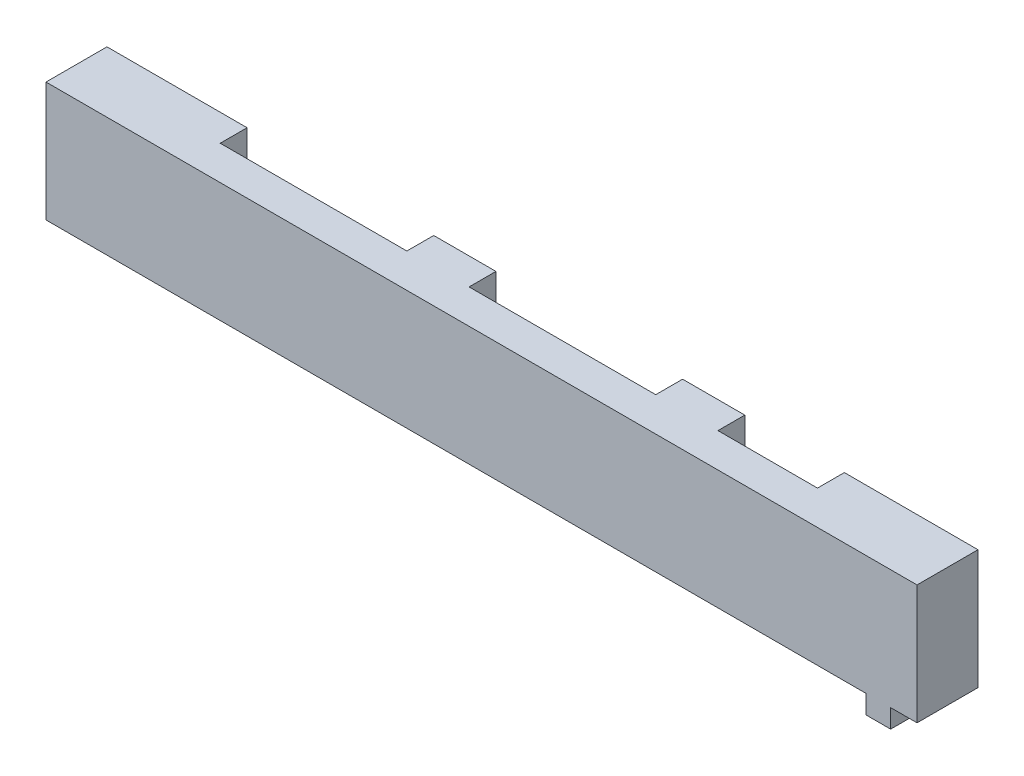
from build123d import *

# Parameters (mm, degrees)
SKETCH_1_W          = 4.9
SKETCH_1_H          = 9.6
EXTRUDE_1_DEPTH     = 70
SKETCH_2_W          = 8
SKETCH_2_H          = 2.159316865
SKETCH_2_W_2        = 15
CUT_EXTRUDE_1_DEPTH = 71.717892378
SKETCH_3_W          = 2
SKETCH_3_H          = 4.9
EXTRUDE_2_DEPTH     = 1.5


with BuildPart() as part:
    # 草图1 → 凸台-拉伸1 (new body)
    with BuildSketch(Plane(origin=(0, 0, 0), x_dir=(0, 0, -1), z_dir=(1, 0, 0))):
        with Locations((0.526626016, -3.550608051)):
            Rectangle(SKETCH_1_W, SKETCH_1_H)
    extrude(amount=EXTRUDE_1_DEPTH)

    # 草图2 → 切除-拉伸1 (cut, through all)
    with BuildSketch(Plane.XZ.offset(8.350608051)):
        with Locations((55.26, -1.896967583)):
            Rectangle(SKETCH_2_W, SKETCH_2_H)
        with Locations((38.76, -1.896967583)):
            Rectangle(SKETCH_2_W_2, SKETCH_2_H)
        with Locations((18.76, -1.896967583)):
            Rectangle(SKETCH_2_W_2, SKETCH_2_H)
    extrude(amount=-CUT_EXTRUDE_1_DEPTH, mode=Mode.SUBTRACT)

    # 草图3 → 凸台-拉伸2 (add)
    with BuildSketch(Plane.XZ.offset(8.350608051)):
        with Locations((66.88, -0.526626016)):
            Rectangle(SKETCH_3_W, SKETCH_3_H)
    extrude(amount=EXTRUDE_2_DEPTH)


solid = part.part
